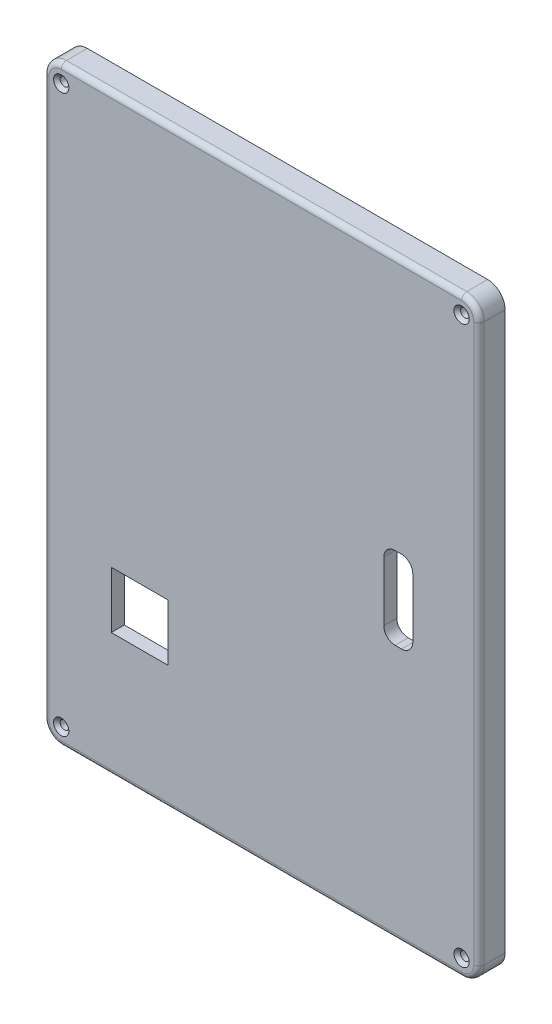
from build123d import *

# Parameters (mm, degrees)
SKETCH_1_W          = 50
SKETCH_1_H          = 68
EXTRUDE_1_DEPTH     = 3
FILLET_1_R          = 2
SKETCH_1_5_R        = 0.5
CUT_EXTRUDE_1_DEPTH = 43.308391603
SKETCH_1_6_W        = 43
SKETCH_1_6_H        = 61
CUT_EXTRUDE_2_DEPTH = 1.5
CHAMFER_1_SIZE      = 0.376
CUT_EXTRUDE_3_DEPTH = 43.308391603
SKETCH_6_W          = 14
SKETCH_6_H          = 7
CUT_EXTRUDE_4_DEPTH = 2
SKETCH_6_3_W        = 6.5
SKETCH_6_3_H        = 6.5
CUT_EXTRUDE_5_DEPTH = 43.308391603
FILLET_2_R          = 0.6


with BuildPart() as part:
    # 草图1 → 凸台-拉伸1 (new body)
    with BuildSketch(Plane.XY):
        Rectangle(SKETCH_1_W, SKETCH_1_H)
    extrude(amount=EXTRUDE_1_DEPTH)

    # 圆角1
    fillet_1_edges = [part.edges().sort_by_distance(p)[0] for p in [
        (-25, -34, 1.5),
        (25, -34, 1.5),
        (25, 34, 1.5),
        (-25, 34, 1.5),
    ]]
    fillet(fillet_1_edges, radius=FILLET_1_R)

    # 草图1<5> → 切除-拉伸1 (cut, through all)
    with BuildSketch(Plane.XY):
        with Locations((-23, 32)):
            Circle(SKETCH_1_5_R)
        with Locations((23, 32)):
            Circle(SKETCH_1_5_R)
        with Locations((23, -32)):
            Circle(SKETCH_1_5_R)
        with Locations((-23, -32)):
            Circle(SKETCH_1_5_R)
    extrude(amount=CUT_EXTRUDE_1_DEPTH, mode=Mode.SUBTRACT)

    # 草图1<6> → 切除-拉伸2 (cut)
    with BuildSketch(Plane.XY):
        Rectangle(SKETCH_1_6_W, SKETCH_1_6_H)
    extrude(amount=CUT_EXTRUDE_2_DEPTH, mode=Mode.SUBTRACT)

    # 倒角1
    chamfer_1_edges = [part.edges().sort_by_distance(p)[0] for p in [
        (-23.5, -32, 3),
        (-23.5, 32, 3),
        (22.5, 32, 3),
        (22.5, -32, 3),
    ]]
    chamfer(chamfer_1_edges, length=CHAMFER_1_SIZE)

    # 草图5 → 切除-拉伸3 (cut, through all)
    with BuildSketch(Plane.XY.offset(3)):
        with BuildLine():
            Line((15.357692994, -4.714172352), (16.090307006, -4.714172352))
            ThreePointArc((16.090307006, -4.714172352), (17.009545821, -4.333411167), (17.390307006, -3.414172352))
            Line((17.390307006, -3.414172352), (17.390307006, 3.414172352))
            ThreePointArc((17.390307006, 3.414172352), (17.009545821, 4.333411167), (16.090307006, 4.714172352))
            Line((16.090307006, 4.714172352), (15.357692994, 4.714172352))
            ThreePointArc((15.357692994, 4.714172352), (14.438454179, 4.333411167), (14.057692994, 3.414172352))
            Line((14.057692994, 3.414172352), (14.057692994, -3.414172352))
            ThreePointArc((14.057692994, -3.414172352), (14.438454179, -4.333411167), (15.357692994, -4.714172352))
        make_face()
    extrude(amount=-CUT_EXTRUDE_3_DEPTH, mode=Mode.SUBTRACT)

    # 草图6 → 切除-拉伸4 (cut)
    with BuildSketch(Plane.XY):
        with Locations((0, 15)):
            Rectangle(SKETCH_6_W, SKETCH_6_H)
    extrude(amount=CUT_EXTRUDE_4_DEPTH, mode=Mode.SUBTRACT)

    # 草图6<3> → 切除-拉伸5 (cut, through all)
    with BuildSketch(Plane.XY):
        with Locations((-14, -16.5)):
            Rectangle(SKETCH_6_3_W, SKETCH_6_3_H)
    extrude(amount=CUT_EXTRUDE_5_DEPTH, mode=Mode.SUBTRACT)

    # 圆角2
    fillet_2_edges = [part.edges().sort_by_distance(p)[0] for p in [
        (-24.414213562, 33.414213562, 3),
        (0, 34, 3),
        (24.414213562, 33.414213562, 3),
        (25, 0, 3),
        (24.414213562, -33.414213562, 3),
        (0, -34, 3),
        (-24.414213562, -33.414213562, 3),
        (-25, 0, 3),
    ]]
    fillet(fillet_2_edges, radius=FILLET_2_R)


solid = part.part
